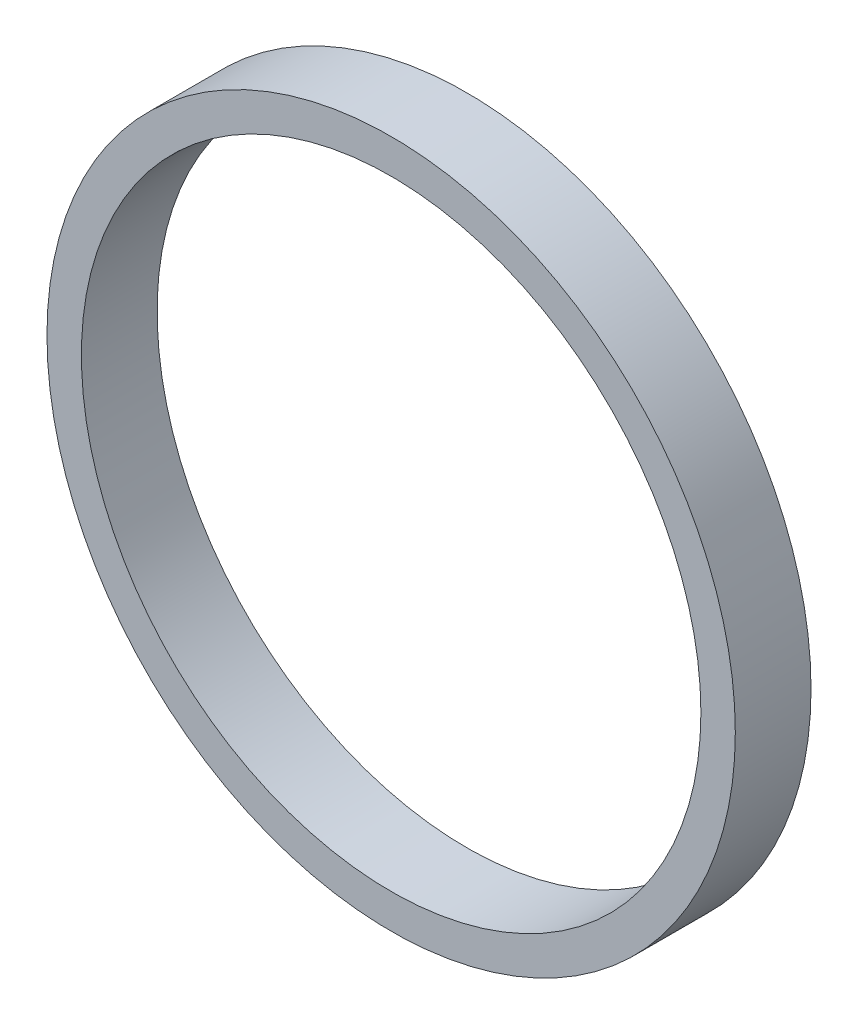
from build123d import *

# Parameters (mm, degrees)
SKIZZE1_R                            = 50
AUFSATZ_LINEAR_AUSTRAGEN1_DEPTH      = 11
SCHNITT_LINEAR_AUSTRAGEN1_DEPTH      = 72.561162651
SCHNITT_LINEAR_AUSTRAGEN1_DEPTH_BACK = 72.561162651
SKIZZE2_R                            = 45


with BuildPart() as part:
    # Skizze1 → Aufsatz-Linear austragen1 (new body)
    with BuildSketch(Plane.XY):
        Circle(SKIZZE1_R)
    extrude(amount=AUFSATZ_LINEAR_AUSTRAGEN1_DEPTH)

    # Skizze2 → Schnitt-Linear austragen1 (cut, two sides: drawn at the far end of the back side and taken through both)
    with BuildSketch(Plane.XY.offset(11).offset(-SCHNITT_LINEAR_AUSTRAGEN1_DEPTH_BACK)):
        Circle(SKIZZE2_R)
    extrude(amount=SCHNITT_LINEAR_AUSTRAGEN1_DEPTH + SCHNITT_LINEAR_AUSTRAGEN1_DEPTH_BACK, mode=Mode.SUBTRACT)


solid = part.part
